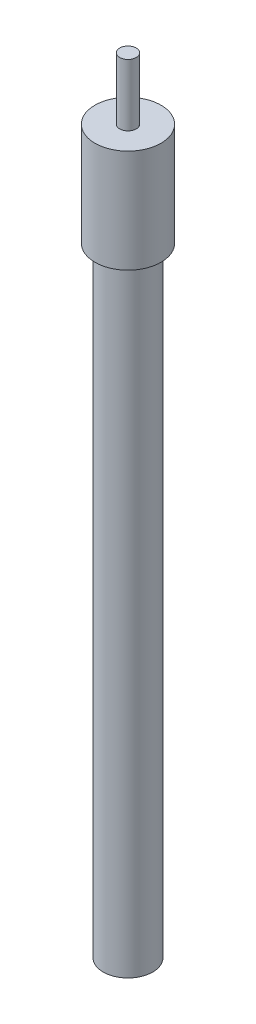
from build123d import *

# Parameters (mm, degrees)
SKETCH1_R            = 6
ELECTRODE_BODY_DEPTH = 150
CAP_START            = 150
SKETCH2_R            = 8
CAP_DEPTH            = 25
CABLE_STUB_START     = 175
SKETCH3_R            = 2
CABLE_STUB_DEPTH     = 15
SKETCH4_R            = 2
PLATINUM_TIP_DEPTH   = 1.5


with BuildPart() as part:
    # Sketch1 → Electrode_Body (new body)
    with BuildSketch(Plane(origin=(0, 0, 0), x_dir=(1, 0, 0), z_dir=(0, 1, 0))):
        with Locations(Location((0, 0, 0), (0, 0, 270))):
            Circle(SKETCH1_R)
    extrude(amount=ELECTRODE_BODY_DEPTH)

    # Sketch2 → Cap (add)
    with BuildSketch(Plane(origin=(0, 0, 0), x_dir=(1, 0, 0), z_dir=(0, 1, 0)).offset(CAP_START)):
        with Locations(Location((0, 0, 0), (0, 0, 270))):
            Circle(SKETCH2_R)
    extrude(amount=CAP_DEPTH)

    # Sketch3 → Cable_Stub (add)
    with BuildSketch(Plane(origin=(0, 0, 0), x_dir=(1, 0, 0), z_dir=(0, 1, 0)).offset(CABLE_STUB_START)):
        with Locations(Location((0, 0, 0), (0, 0, 270))):
            Circle(SKETCH3_R)
    extrude(amount=CABLE_STUB_DEPTH)

    # Sketch4 → Platinum_Tip (add)
    with BuildSketch(Plane(origin=(0, 0, 0), x_dir=(1, 0, 0), z_dir=(0, 1, 0))):
        with Locations(Location((0, 0, 0), (0, 0, 270))):
            Circle(SKETCH4_R)
    extrude(amount=PLATINUM_TIP_DEPTH)


solid = part.part
